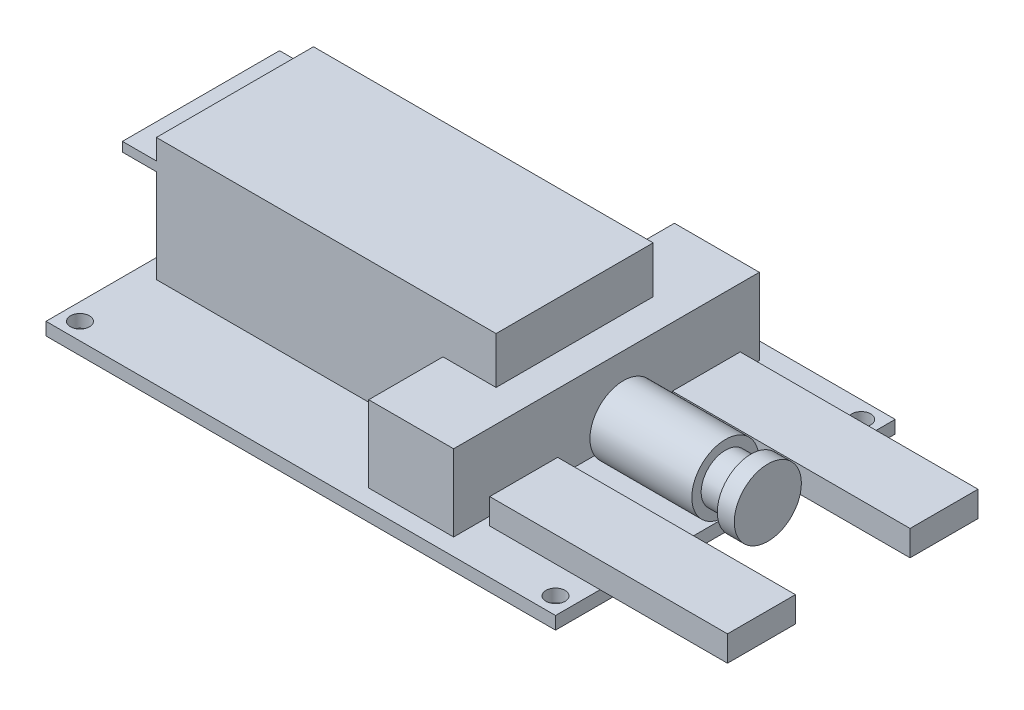
from build123d import *

# Parameters (mm, degrees)
SKETCH1_W                  = 60
SKETCH1_H                  = 40
SKETCH1_R                  = 1.125
BOSS_EXTRUDE1_DEPTH        = 1.5
SKETCH2_R                  = 3.95
BOSS_EXTRUDE2_DEPTH        = 12
SKETCH4_R                  = 2.85
BOSS_EXTRUDE3_DEPTH        = 3
BOSS_EXTRUDE4_START        = 3
SKETCH2_2_R                = 3.95
BOSS_EXTRUDE4_DEPTH        = 2
BOSS_EXTRUDE5_DEPTH        = 15
BOSS_EXTRUDE5_DEPTH_BACK   = 13
SKETCH5_W                  = 8
SKETCH5_H                  = 3
BOSS_EXTRUDE5_2_DEPTH      = 15
BOSS_EXTRUDE5_2_DEPTH_BACK = 13
SKETCH6_W                  = 10
SKETCH6_H                  = 36
BOSS_EXTRUDE6_DEPTH        = 9
SKETCH11_W                 = 44
SKETCH11_H                 = 18.5
BOSS_EXTRUDE11_DEPTH       = 14.5
SKETCH12_W                 = 18.5
SKETCH12_H                 = 11
CUT_EXTRUDE1_DEPTH         = 4
SKETCH13_W                 = 18.5
SKETCH13_H                 = 2.4
CUT_EXTRUDE2_DEPTH         = 4


with BuildPart() as part:
    # Sketch1 → Boss-Extrude1 (new body)
    with BuildSketch(Plane(origin=(0, 0, 0), x_dir=(1, 0, 0), z_dir=(0, 1, 0))):
        Rectangle(SKETCH1_W, SKETCH1_H)
        with Locations((-28, 18)):
            Circle(SKETCH1_R, mode=Mode.SUBTRACT)
        with Locations((28, 18)):
            Circle(SKETCH1_R, mode=Mode.SUBTRACT)
        with Locations((-28, -18)):
            Circle(SKETCH1_R, mode=Mode.SUBTRACT)
        with Locations((28, -18)):
            Circle(SKETCH1_R, mode=Mode.SUBTRACT)
    extrude(amount=-BOSS_EXTRUDE1_DEPTH)

    # Sketch6 → Boss-Extrude6 (add)
    with BuildSketch(Plane(origin=(0, 0, 0), x_dir=(1, 0, 0), z_dir=(0, 1, 0))):
        with Locations((11, 0)):
            Rectangle(SKETCH6_W, SKETCH6_H)
    extrude(amount=BOSS_EXTRUDE6_DEPTH)

    # Sketch11 → Boss-Extrude11 (add)
    with BuildSketch(Plane(origin=(0, 0, 0), x_dir=(1, 0, 0), z_dir=(0, 1, 0))):
        with Locations((-9.75, 0)):
            Rectangle(SKETCH11_W, SKETCH11_H)
    extrude(amount=BOSS_EXTRUDE11_DEPTH)

    # Sketch12 → Cut-Extrude1 (cut)
    with BuildSketch(Plane.ZY.offset(31.75)):
        with Locations((0, 5.5)):
            Rectangle(SKETCH12_W, SKETCH12_H)
    extrude(amount=-CUT_EXTRUDE1_DEPTH, mode=Mode.SUBTRACT)

    # Sketch13 → Cut-Extrude2 (cut)
    with BuildSketch(Plane.ZY.offset(31.75)):
        with Locations((0, 13.3)):
            Rectangle(SKETCH13_W, SKETCH13_H)
    extrude(amount=-CUT_EXTRUDE2_DEPTH, mode=Mode.SUBTRACT)


with BuildPart() as body_2:
    # Sketch2 → Boss-Extrude2 (new body)
    with BuildSketch(Plane(origin=(30, 0, 0), x_dir=(0, 0, -1), z_dir=(1, 0, 0))):
        with Locations((0, 4)):
            Circle(SKETCH2_R)
    extrude(amount=-BOSS_EXTRUDE2_DEPTH)


with BuildPart() as body_3:
    # Sketch4 → Boss-Extrude3 (new body)
    with BuildSketch(Plane(origin=(30, 0, 0), x_dir=(0, 0, -1), z_dir=(1, 0, 0))):
        with Locations((0, 4)):
            Circle(SKETCH4_R)
    extrude(amount=BOSS_EXTRUDE3_DEPTH)


with BuildPart() as body_4:
    # Sketch2<2> → Boss-Extrude4 (new body)
    with BuildSketch(Plane(origin=(30, 0, 0), x_dir=(0, 0, -1), z_dir=(1, 0, 0)).offset(BOSS_EXTRUDE4_START)):
        with Locations((0, 4)):
            Circle(SKETCH2_2_R)
    extrude(amount=BOSS_EXTRUDE4_DEPTH)


with BuildPart() as body_5:
    # Sketch5 → Boss-Extrude5 (new, two sides: drawn at the far end of the back side and taken through both)
    with BuildSketch(Plane(origin=(30, 0, 0), x_dir=(0, 0, -1), z_dir=(1, 0, 0)).offset(-BOSS_EXTRUDE5_DEPTH_BACK)):
        with Locations((-10.75, 1.5)):
            Rectangle(SKETCH5_W, SKETCH5_H)
    extrude(amount=BOSS_EXTRUDE5_DEPTH + BOSS_EXTRUDE5_DEPTH_BACK)


with BuildPart() as body_6:
    # Sketch5 → Boss-Extrude5 2 (new, two sides: drawn at the far end of the back side and taken through both)
    with BuildSketch(Plane(origin=(30, 0, 0), x_dir=(0, 0, -1), z_dir=(1, 0, 0)).offset(-BOSS_EXTRUDE5_2_DEPTH_BACK)):
        with Locations((10.75, 1.5)):
            Rectangle(SKETCH5_W, SKETCH5_H)
    extrude(amount=BOSS_EXTRUDE5_2_DEPTH + BOSS_EXTRUDE5_2_DEPTH_BACK)


solid = Compound([part.part, body_2.part, body_3.part, body_4.part, body_5.part, body_6.part])
